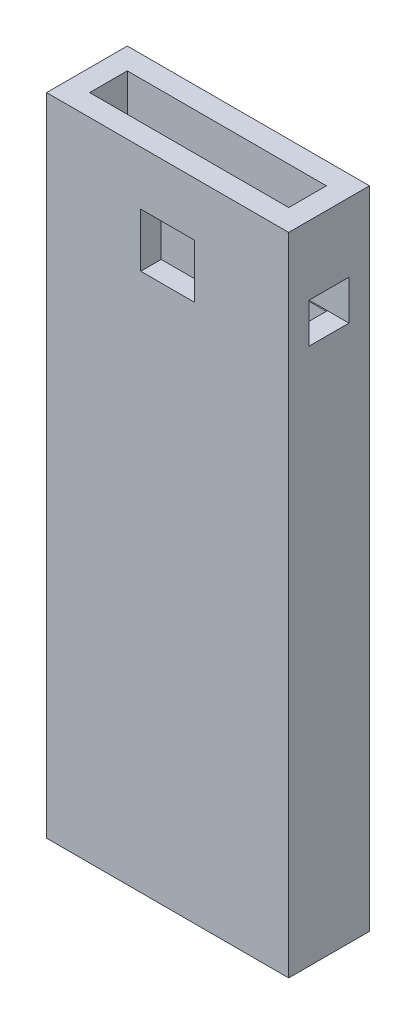
from build123d import *

# Parameters (mm, degrees)
SKETCH1_W                 = 45
SKETCH1_H                 = 15
BOSS_EXTRUDE1_DEPTH       = 60
SHELL1_T                  = -4
SHELL1_THICKNESS_2_FACE_W = 7
SHELL1_THICKNESS_2_FACE_H = 37
SHELL1_THICKNESS_2_DEPTH  = 2
SKETCH3_W                 = 10
SKETCH3_H                 = 7
CUT_EXTRUDE2_DEPTH        = 4
CUT_EXTRUDE3_REACH        = 67.812
SKETCH4_W                 = 10
SKETCH4_H                 = 10
SKETCH5_W                 = 7.4
SKETCH5_H                 = 7.4
CUT_EXTRUDE4_DEPTH        = 76.374067158
CUT_EXTRUDE5_START        = -1.2
CUT_EXTRUDE5_DEPTH        = 3.6
SKETCH7_R                 = 2.1
CUT_EXTRUDE6_DEPTH        = 123.321298227


with BuildPart() as part:
    # Sketch1 → Boss-Extrude1 (new, symmetric)
    with BuildSketch(Plane(origin=(0, 0, 0), x_dir=(1, 0, 0), z_dir=(0, 1, 0))):
        Rectangle(SKETCH1_W, SKETCH1_H)
    extrude(amount=BOSS_EXTRUDE1_DEPTH, both=True)

    # Shell1
    shell1_openings = [part.faces().sort_by_distance(p)[0] for p in [
        (0, 60, 0),
    ]]
    offset(amount=SHELL1_T, openings=shell1_openings, kind=Kind.INTERSECTION)

    # Shell1 thickness 2 face (on inner face of the shell) → Shell1 thickness 2 (add)
    with BuildSketch(Plane(origin=(0, -56, 0), x_dir=(0, 0, -1), z_dir=(0, -1, 0))):
        Rectangle(SHELL1_THICKNESS_2_FACE_W, SHELL1_THICKNESS_2_FACE_H)
    extrude(amount=-SHELL1_THICKNESS_2_DEPTH)

    # Sketch3 → Cut-Extrude2 (cut)
    with BuildSketch(Plane.XZ.offset(60)):
        Rectangle(SKETCH3_W, SKETCH3_H)
    extrude(amount=-CUT_EXTRUDE2_DEPTH, mode=Mode.SUBTRACT)

    # Sketch4 → Cut-Extrude3 (cut, up to next)
    with BuildSketch(Plane.XY.offset(7.5), mode=Mode.PRIVATE) as cut_extrude3_sk1:
        with Locations((0, 45)):
            Rectangle(SKETCH4_W, SKETCH4_H)
    cut_extrude3_tool1 = extrude(cut_extrude3_sk1.sketch, amount=-CUT_EXTRUDE3_REACH, mode=Mode.PRIVATE) & part.part
    add(cut_extrude3_tool1.solids().sort_by_distance((0, 45, 7.5))[0], mode=Mode.SUBTRACT)

    # Sketch5 → Cut-Extrude4 (cut, through all)
    with BuildSketch(Plane(origin=(22.5, 0, 0), x_dir=(0, 0, -1), z_dir=(1, 0, 0))):
        with Locations((0, 43.5)):
            Rectangle(SKETCH5_W, SKETCH5_H)
    extrude(amount=-CUT_EXTRUDE4_DEPTH, mode=Mode.SUBTRACT)

    # Sketch6 → Cut-Extrude5 (cut)
    with BuildSketch(Plane.XZ.offset(60).offset(CUT_EXTRUDE5_START)):
        Polygon((-15, 4.272391992), (-18.7, 2.136195996), (-18.7, -2.136195996), (-15, -4.272391992), (-11.3, -2.136195996), (-11.3, 2.136195996), align=None)
        Polygon((11.3, 2.136195996), (15, 4.272391992), (18.7, 2.136195996), (18.7, -2.136195996), (15, -4.272391992), (11.3, -2.136195996), align=None)
    extrude(amount=-CUT_EXTRUDE5_DEPTH, mode=Mode.SUBTRACT)

    # Sketch7 → Cut-Extrude6 (cut, through all)
    with BuildSketch(Plane.XZ.offset(60)):
        with Locations(Location((-15, 0, 0), (0, 0, 270))):
            Circle(SKETCH7_R)
        with Locations(Location((15, 0, 0), (0, 0, 90))):
            Circle(SKETCH7_R)
    extrude(amount=-CUT_EXTRUDE6_DEPTH, mode=Mode.SUBTRACT)


solid = part.part
